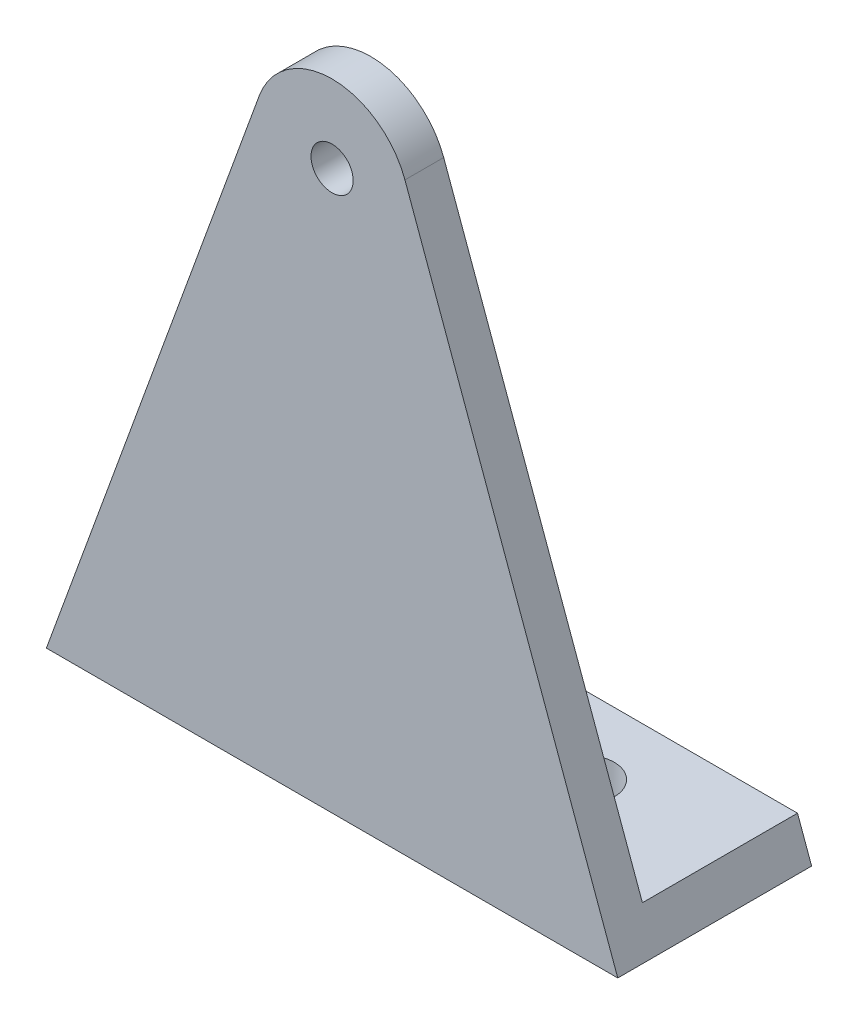
from build123d import *

# Parameters (mm, degrees)
BOSS_EXTRUDE1_DEPTH           = 3.175
TAP_DRILL_FOR_8_32_TAP1_D     = 3.4544
TAP_DRILL_FOR_8_32_TAP1_DEPTH = 3.302
TAP_DRILL_FOR_8_32_TAP1_TIP   = 1.037806461
BOSS_EXTRUDE2_DEPTH           = 12.7
F_8_CLEARANCE_HOLE1_D         = 4.9149


with BuildPart() as part:
    # Sketch1 → Boss-Extrude1 (new body)
    with BuildSketch(Plane.XY):
        with BuildLine():
            Line((-9.149583802, 21.93801689), (-26.580783626, -25.95381102))
            Line((-26.580783626, -25.95381102), (20.215712306, -25.95381102))
            Line((20.215712306, -25.95381102), (2.784512482, 21.93801689))
            ThreePointArc((2.784512482, 21.93801689), (-3.18253566, 26.11618898), (-9.149583802, 21.93801689))
        make_face()
    extrude(amount=BOSS_EXTRUDE1_DEPTH)

    # Tap Drill for #8-32 Tap1
    with Locations(Plane(origin=(-3.18253566, 19.76618898, 0), x_dir=(-1, 0, 0), z_dir=(0, 0, -1))):
        with Locations((0, 0)):
            Hole(TAP_DRILL_FOR_8_32_TAP1_D / 2, depth=TAP_DRILL_FOR_8_32_TAP1_DEPTH)
            with Locations((0, 0, -(TAP_DRILL_FOR_8_32_TAP1_DEPTH + TAP_DRILL_FOR_8_32_TAP1_TIP / 2))):  # 118° drill point
                Cone(0, TAP_DRILL_FOR_8_32_TAP1_D / 2, TAP_DRILL_FOR_8_32_TAP1_TIP, mode=Mode.SUBTRACT)

    # Sketch3 → Boss-Extrude2 (add)
    with BuildSketch(Plane(origin=(0, 0, 0), x_dir=(-1, 0, 0), z_dir=(0, 0, -1))):
        Polygon((-19.060106812, -22.77881102), (-20.215712306, -25.95381102), (26.580783626, -25.95381102), (25.425178132, -22.77881102), align=None)
    extrude(amount=BOSS_EXTRUDE2_DEPTH)

    # #8 Clearance Hole1 (through all)
    with Locations(Plane(origin=(-14.303856896, -22.77881102, -6.35), x_dir=(1, 0, 0), z_dir=(0, 1, 0))):
        with Locations((0, 0), (22.242642472, 0)):
            Hole(F_8_CLEARANCE_HOLE1_D / 2)


solid = part.part
